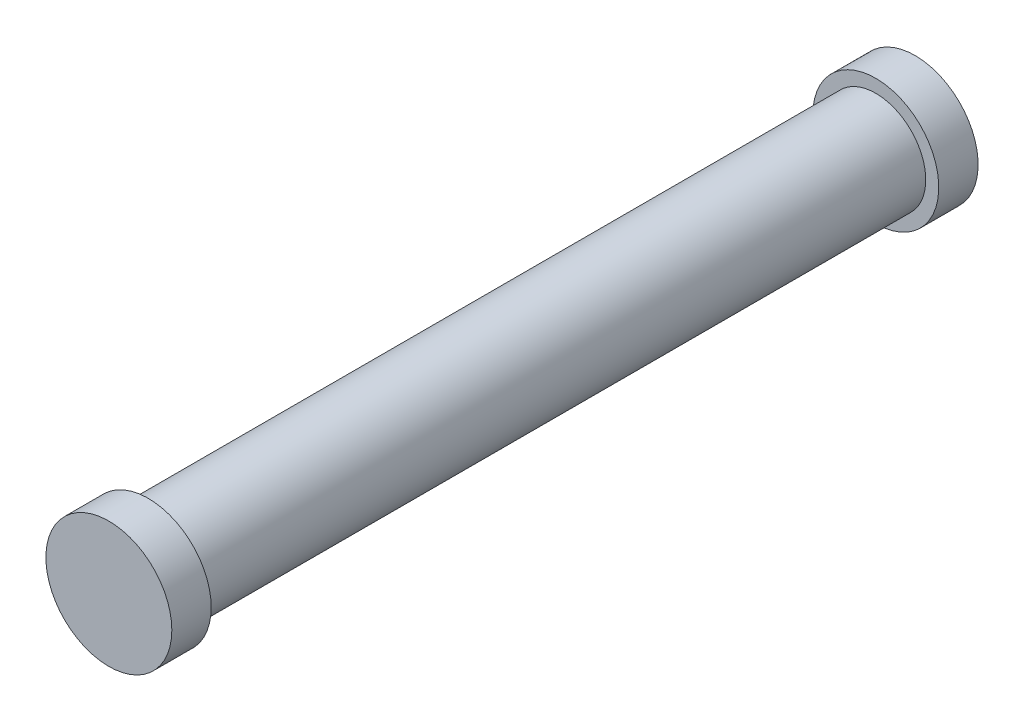
from build123d import *

# Parameters (mm, degrees)
SKETCH1_R           = 9.525
BOSS_EXTRUDE1_DEPTH = 138.63105676
SKETCH2_R           = 12
BOSS_EXTRUDE2_DEPTH = 7.5
BOSS_EXTRUDE3_START = 7.5
SKETCH3_R           = 12
BOSS_EXTRUDE3_DEPTH = 7.5


with BuildPart() as part:
    # Sketch1 → Boss-Extrude1 (new body)
    with BuildSketch(Plane.XY):
        Circle(SKETCH1_R)
    extrude(amount=BOSS_EXTRUDE1_DEPTH)

    # Sketch2 → Boss-Extrude2 (add)
    with BuildSketch(Plane.XY.offset(138.63105676)):
        Circle(SKETCH2_R)
    extrude(amount=BOSS_EXTRUDE2_DEPTH)

    # Sketch3 → Boss-Extrude3 (add)
    with BuildSketch(Plane(origin=(0, 0, 0), x_dir=(-1, 0, 0), z_dir=(0, 0, -1)).offset(BOSS_EXTRUDE3_START)):
        with Locations(Location((0, 0, 0), (0, 0, 180))):
            Circle(SKETCH3_R)
    extrude(amount=-BOSS_EXTRUDE3_DEPTH)


solid = part.part
